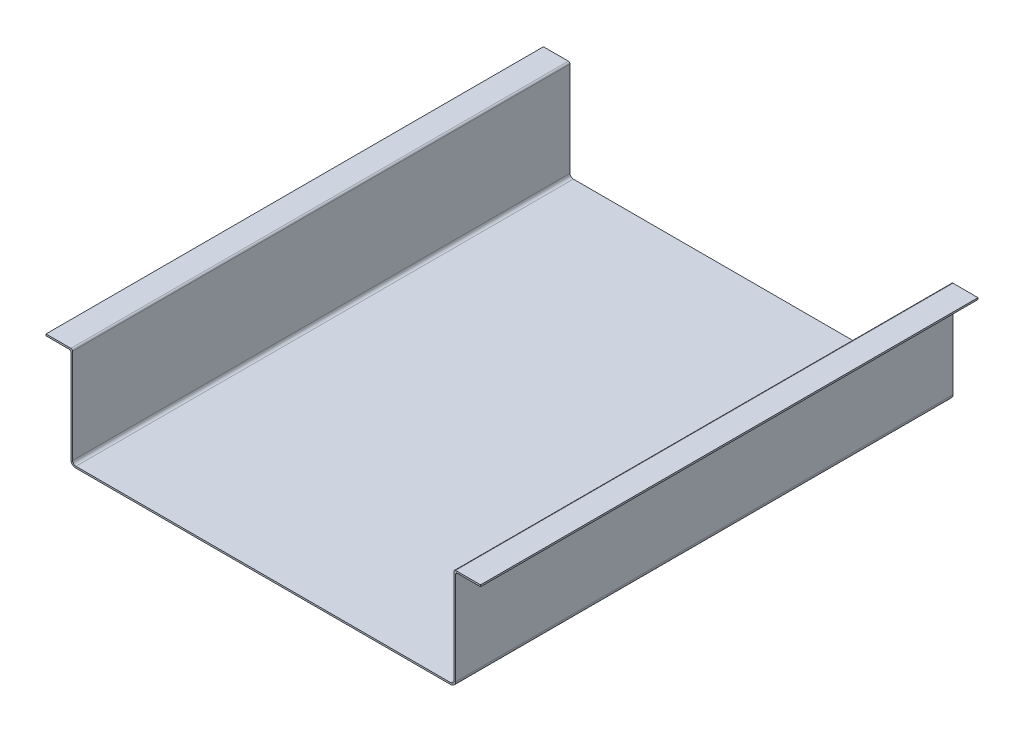
from build123d import *

# Parameters (mm, degrees)
BOSS_EXTRUDE1_DEPTH = 475.488


with BuildPart() as part:
    # Sketch2 → Boss-Extrude1 (new body)
    with BuildSketch(Plane.XY):
        with BuildLine():
            Line((-179.1462, 0), (179.1462, 0))
            ThreePointArc((179.1462, 0), (182.504815789, 1.391184211), (183.896, 4.7498))
            Line((183.896, 4.7498), (183.896, 93.6625))
            ThreePointArc((183.896, 93.6625), (184.360967985, 94.785032015), (185.4835, 95.25))
            Line((185.4835, 95.25), (207.6958, 95.25))
            Line((207.6958, 95.25), (207.6958, 96.8502))
            Line((207.6958, 96.8502), (183.8833, 96.8502))
            ThreePointArc((183.8833, 96.8502), (182.760767985, 96.385232015), (182.2958, 95.2627))
            Line((182.2958, 95.2627), (182.2958, 4.7625))
            ThreePointArc((182.2958, 4.7625), (181.36586403, 2.51743597), (179.1208, 1.5875))
            Line((179.1208, 1.5875), (-179.1208, 1.5875))
            ThreePointArc((-179.1208, 1.5875), (-181.36586403, 2.51743597), (-182.2958, 4.7625))
            Line((-182.2958, 4.7625), (-182.2958, 95.25))
            Line((-182.2958, 95.25), (-182.2958, 95.2627))
            ThreePointArc((-182.2958, 95.2627), (-182.760767985, 96.385232015), (-183.8833, 96.8502))
            Line((-183.8833, 96.8502), (-207.6958, 96.8502))
            Line((-207.6958, 96.8502), (-207.6958, 95.25))
            Line((-207.6958, 95.25), (-185.4835, 95.25))
            ThreePointArc((-185.4835, 95.25), (-184.360967985, 94.785032015), (-183.896, 93.6625))
            Line((-183.896, 93.6625), (-183.896, 4.7498))
            ThreePointArc((-183.896, 4.7498), (-182.504815789, 1.391184211), (-179.1462, 0))
        make_face()
    extrude(amount=BOSS_EXTRUDE1_DEPTH)


solid = part.part
